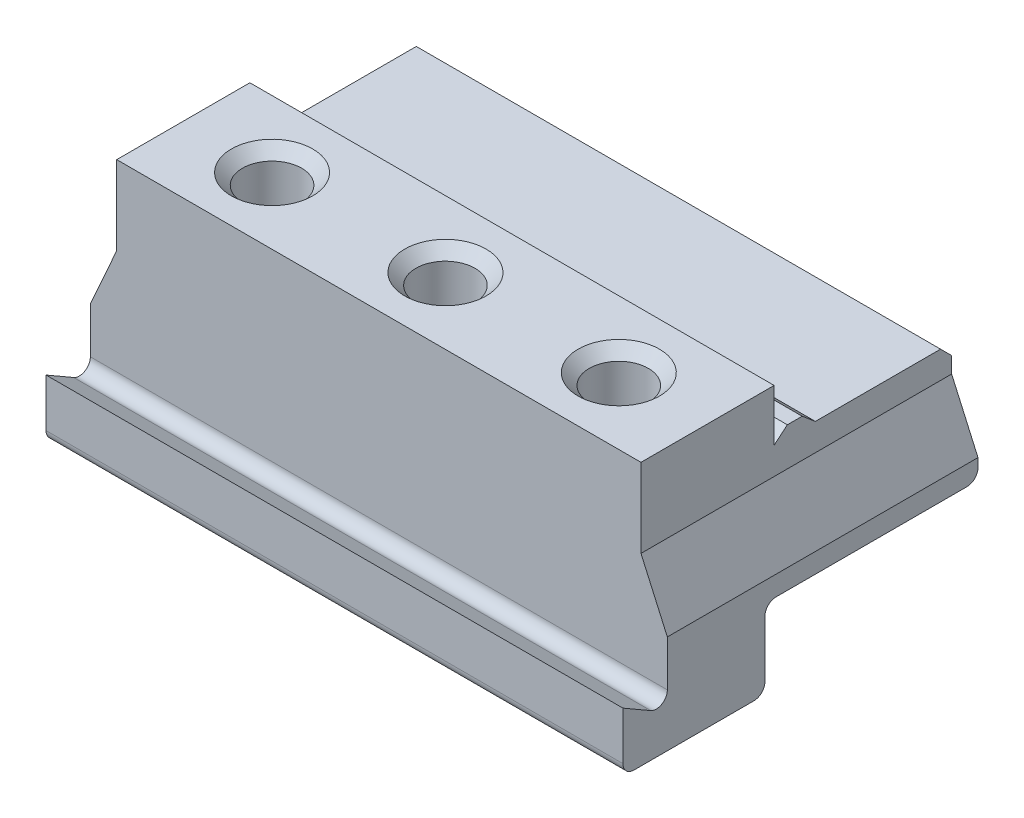
from build123d import *

# Parameters (mm, degrees)
BOSS_EXTRUDE1_DEPTH     = 39
CUT_EXTRUDE1_DEPTH      = 53.796769788
CUT_EXTRUDE2_DEPTH      = 58.361049502
CUT_EXTRUDE2_DEPTH_BACK = 10
SKETCH3_R               = 4
CHAMFER1_SIZE           = 1.5


with BuildPart() as part:
    # Sketch1 → Boss-Extrude1 (new, symmetric)
    with BuildSketch(Plane(origin=(0, 0, 0), x_dir=(0, 0, -1), z_dir=(1, 0, 0))):
        with BuildLine():
            Line((-1.5, 0), (-1.5, -7.67))
            ThreePointArc((-1.5, -7.67), (-1.939339828, -8.730660172), (-3, -9.17))
            Line((-3, -9.17), (-19.2, -9.17))
            ThreePointArc((-19.2, -9.17), (-20.260660172, -8.730660172), (-20.7, -7.67))
            Line((-20.7, -7.67), (-20.7, -1.17))
            Line((-20.7, -1.17), (-16.95, -3.335063509))
            ThreePointArc((-16.95, -3.335063509), (-15.45, -3.335063509), (-14.7, -2.036025404))
            Line((-14.7, -2.036025404), (-14.7, 22.83))
            Line((-14.7, 22.83), (3.3, 22.83))
            Line((3.3, 22.83), (3.3, 15.83))
            Line((3.3, 15.83), (5.087630389, 17.33))
            Line((5.087630389, 17.33), (7.087630389, 17.33))
            Line((7.087630389, 17.33), (8.875260778, 15.83))
            Line((8.875260778, 15.83), (25.8, 15.83))
            Line((25.8, 15.83), (27.3, 14.33))
            Line((27.3, 14.33), (27.3, 3))
            ThreePointArc((27.3, 3), (26.860660172, 1.939339828), (25.8, 1.5))
            Line((25.8, 1.5), (0, 1.5))
            ThreePointArc((0, 1.5), (-1.060660172, 1.060660172), (-1.5, 0))
        make_face()
    extrude(amount=BOSS_EXTRUDE1_DEPTH, both=True)

    # Sketch2 → Cut-Extrude1 (cut, symmetric)
    with BuildSketch(Plane.XY):
        Polygon((-39, 22.83), (-35.438170518, 22.83), (-35.438170518, 12.163333333), (-39, 4.163333333), align=None)
    cut_extrude1 = extrude(amount=CUT_EXTRUDE1_DEPTH, both=True, mode=Mode.SUBTRACT)

    # Mirror2: Cut-Extrude1 across plane
    add(cut_extrude1.mirror(Plane(origin=(0, 0, 0), x_dir=(0, 0, 1), z_dir=(1, 0, 0))), mode=Mode.SUBTRACT)

    # Sketch3 → Cut-Extrude2 (cut, two sides: drawn at the far end of the back side and taken through both)
    with BuildSketch(Plane(origin=(0, 22.83, 0), x_dir=(1, 0, 0), z_dir=(0, 1, 0)).offset(-CUT_EXTRUDE2_DEPTH_BACK)):
        with Locations(Location((23.438170518, -5.7, 0), (0, 0, 90))):
            Circle(SKETCH3_R)
        with Locations(Location((0, -5.7, 0), (0, 0, 90))):
            Circle(SKETCH3_R)
        with Locations(Location((-23.438170518, -5.7, 0), (0, 0, 90))):
            Circle(SKETCH3_R)
    extrude(amount=CUT_EXTRUDE2_DEPTH + CUT_EXTRUDE2_DEPTH_BACK, mode=Mode.SUBTRACT)

    # Chamfer1
    chamfer1_edges = [part.edges().sort_by_distance(p)[0] for p in [
        (23.438170518, 22.83, 9.7),
        (0, 22.83, 9.7),
        (-23.438170518, 22.83, 9.7),
    ]]
    chamfer(chamfer1_edges, length=CHAMFER1_SIZE)


solid = part.part
